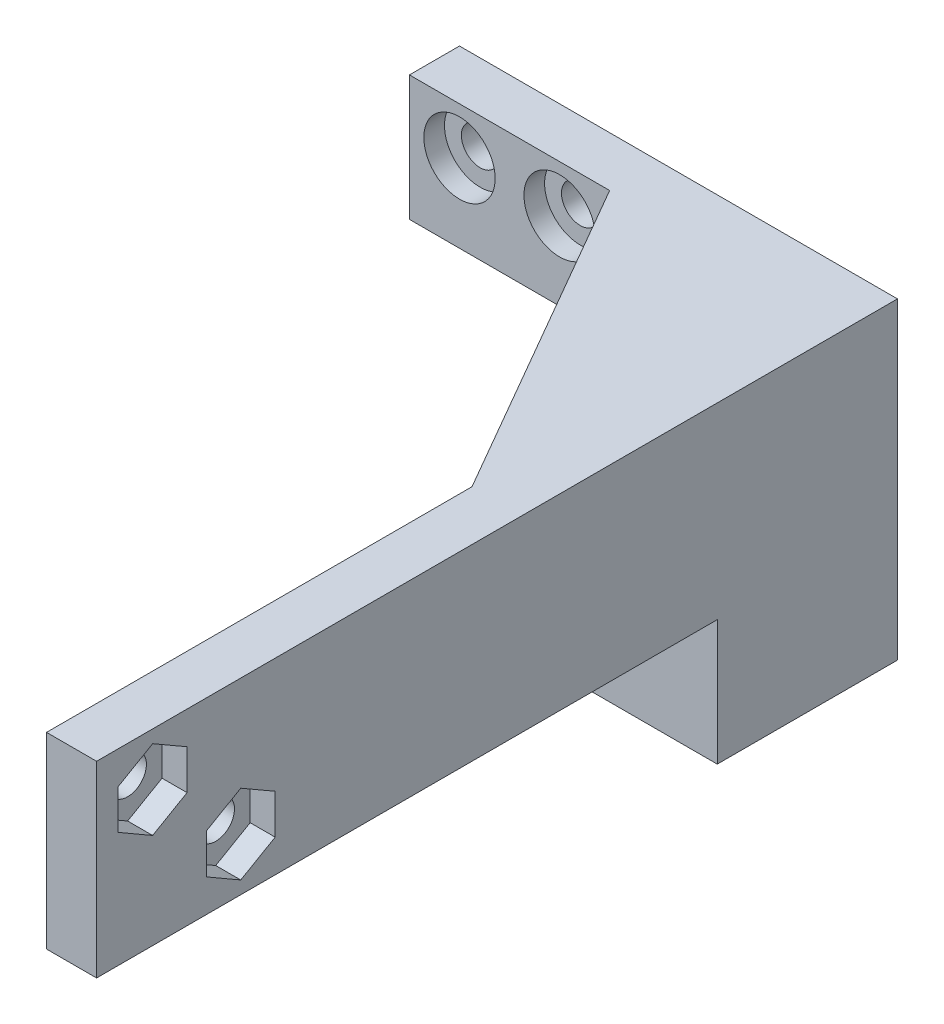
from build123d import *

# Parameters (mm, degrees)
CROQUIS1_W              = 4
CROQUIS1_H              = 15
CROQUIS1_W_2            = 15
CROQUIS1_W_3            = 16
CROQUIS1_R              = 1.5
SALIENTE_EXTRUIR1_DEPTH = 4
CROQUIS2_W              = 4
CROQUIS2_H              = 15
SALIENTE_EXTRUIR2_DEPTH = 60
SALIENTE_EXTRUIR4_START = -7.5
SALIENTE_EXTRUIR4_DEPTH = 15
CROQUIS8_R              = 2.85
CORTAR_EXTRUIR3_DEPTH   = 1.65
CORTAR_EXTRUIR2_REACH   = 114.965
CROQUIS7_R              = 1.5
CORTAR_EXTRUIR5_DEPTH   = 2
CROQUIS10_W             = 22
CROQUIS10_H             = 5
CORTAR_EXTRUIR6_DEPTH   = 22
CROQUIS11_W             = 13
CROQUIS11_H             = 14.4
SALIENTE_EXTRUIR5_DEPTH = 10


with BuildPart() as part:
    # Croquis1 → Saliente-Extruir1 (new body)
    # profile 1 of 3: a face of its own
    with BuildSketch(Plane.XY):
        with Locations((84, 80.273389683)):
            Rectangle(CROQUIS1_W, CROQUIS1_H)
    # profile 2 of 3: a face of its own
    with BuildSketch(Plane.XY):
        with Locations((74.5, 80.273389683)):
            Rectangle(CROQUIS1_W_2, CROQUIS1_H)
    # profile 3 of 3: a face of its own
    with BuildSketch(Plane.XY):
        with Locations((59, 80.273389683)):
            Rectangle(CROQUIS1_W_3, CROQUIS1_H)
        with Locations((55, 84.023389683)):
            Circle(CROQUIS1_R, mode=Mode.SUBTRACT)
        with Locations((63, 84.023389683)):
            Circle(CROQUIS1_R, mode=Mode.SUBTRACT)
    extrude(amount=SALIENTE_EXTRUIR1_DEPTH)

    # Croquis2 → Saliente-Extruir2 (add)
    with BuildSketch(Plane.XY.offset(4)):
        with Locations((84, 80.273389683)):
            Rectangle(CROQUIS2_W, CROQUIS2_H)
    extrude(amount=SALIENTE_EXTRUIR2_DEPTH)

    # Croquis6 → Saliente-Extruir4 (add)
    with BuildSketch(Plane(origin=(0, 80.273389683, 0), x_dir=(-1, 0, 0), z_dir=(0, -1, 0)).offset(SALIENTE_EXTRUIR4_START)):
        Polygon((-82, -30), (-82, -4), (-67, -4), align=None)
    extrude(amount=SALIENTE_EXTRUIR4_DEPTH)

    # Croquis8 → Cortar-Extruir3 (cut)
    with BuildSketch(Plane.XY.offset(4)):
        with Locations((63, 84.023389683)):
            Circle(CROQUIS8_R)
        with Locations((55, 84.023389683)):
            Circle(CROQUIS8_R)
    extrude(amount=-CORTAR_EXTRUIR3_DEPTH, mode=Mode.SUBTRACT)

    # Croquis7 → Cortar-Extruir2 (cut, up to next)
    with BuildSketch(Plane.ZY.offset(-82), mode=Mode.PRIVATE) as cortar_extruir2_sk1:
        with Locations((52.48, 76.973389683)):
            Circle(CROQUIS7_R)
    cortar_extruir2_tool1 = extrude(cortar_extruir2_sk1.sketch, amount=-CORTAR_EXTRUIR2_REACH, mode=Mode.PRIVATE) & part.part
    # Croquis7 → Cortar-Extruir2 (cut, up to next)
    with BuildSketch(Plane.ZY.offset(-82), mode=Mode.PRIVATE) as cortar_extruir2_sk2:
        with Locations((59.52, 83.573389683)):
            Circle(CROQUIS7_R)
    cortar_extruir2_tool2 = extrude(cortar_extruir2_sk2.sketch, amount=-CORTAR_EXTRUIR2_REACH, mode=Mode.PRIVATE) & part.part
    add(cortar_extruir2_tool1.solids().sort_by_distance((82, 76.97339, 52.48))[0], mode=Mode.SUBTRACT)
    add(cortar_extruir2_tool2.solids().sort_by_distance((82, 83.57339, 59.52))[0], mode=Mode.SUBTRACT)

    # Croquis9 → Cortar-Extruir5 (cut)
    with BuildSketch(Plane(origin=(86, 0, 0), x_dir=(0, 0, -1), z_dir=(1, 0, 0))):
        Polygon((-55.23, 75.385676443), (-52.48, 73.797963203), (-49.73, 75.385676443), (-49.73, 78.561102924), (-52.48, 80.148816164), (-55.23, 78.561102924), align=None)
        Polygon((-62.27, 81.985676443), (-59.52, 80.397963203), (-56.77, 81.985676443), (-56.77, 85.161102924), (-59.52, 86.748816164), (-62.27, 85.161102924), align=None)
    extrude(amount=-CORTAR_EXTRUIR5_DEPTH, mode=Mode.SUBTRACT)

    # Croquis10 → Cortar-Extruir6 (cut)
    with BuildSketch(Plane.ZY.offset(-51)):
        with Locations((11, 75.273389683)):
            Rectangle(CROQUIS10_W, CROQUIS10_H)
    extrude(amount=-CORTAR_EXTRUIR6_DEPTH, mode=Mode.SUBTRACT)

    # Croquis11 → Saliente-Extruir5 (add)
    with BuildSketch(Plane.XZ.offset(-72.773389683)):
        with Locations((79.5, 7.2)):
            Rectangle(CROQUIS11_W, CROQUIS11_H)
    extrude(amount=SALIENTE_EXTRUIR5_DEPTH)


solid = part.part
